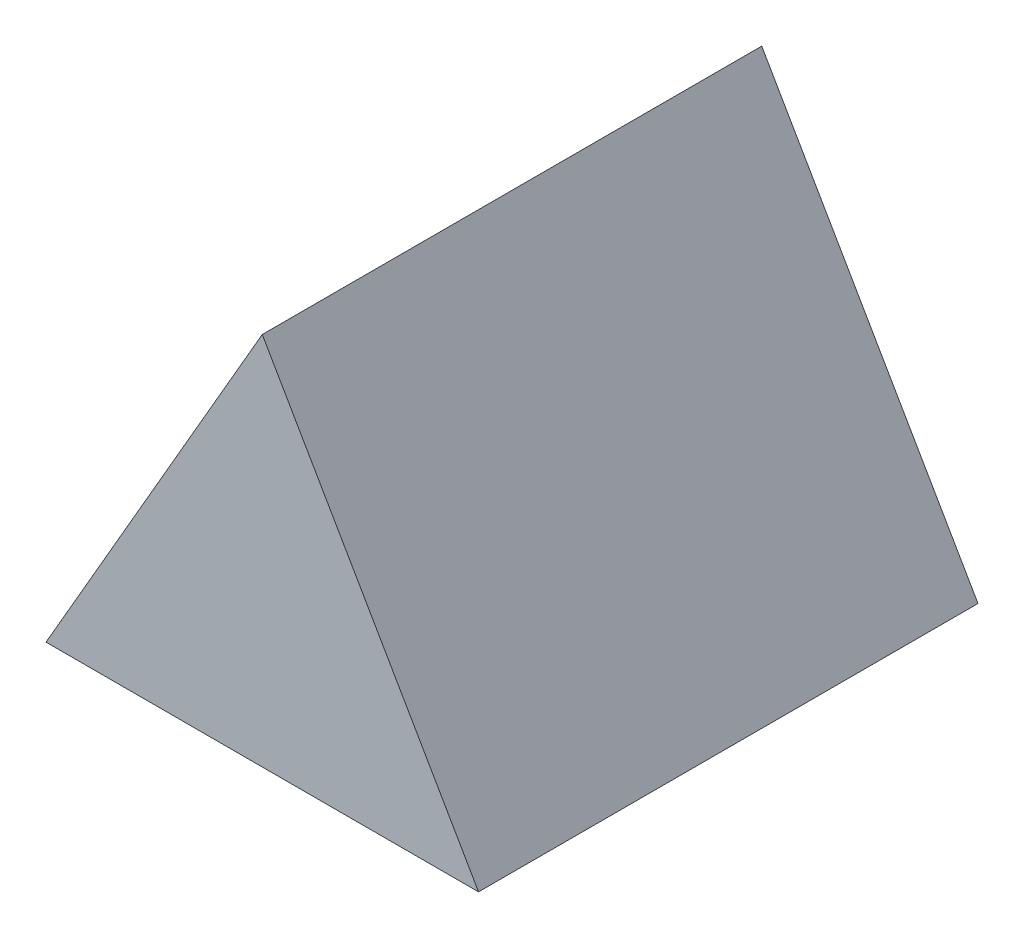
from build123d import *

# Parameters (mm, degrees)
PRISM_DEPTH = 60


with BuildPart() as part:
    # Sketch1 → Prism (new body)
    with BuildSketch(Plane.XY):
        Polygon((0, 30), (-25.980762114, -15), (25.980762114, -15), align=None)
    extrude(amount=PRISM_DEPTH)


solid = part.part
